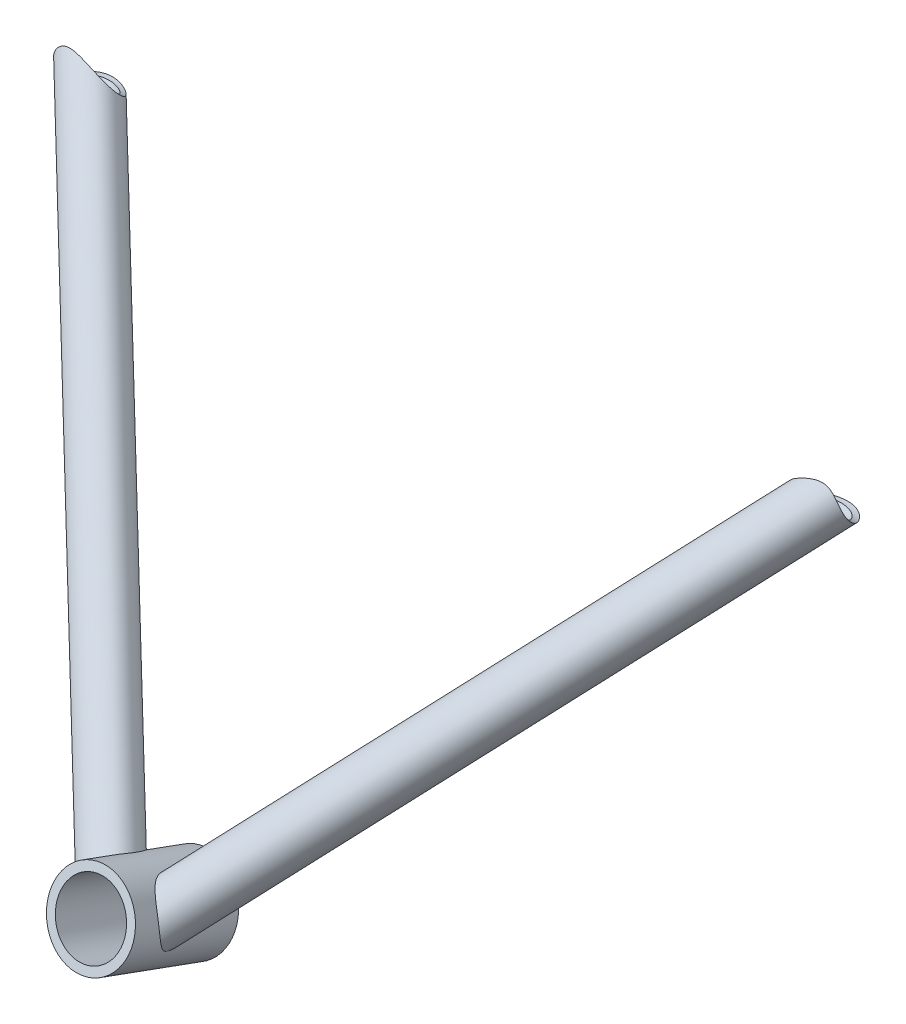
from build123d import *

# Parameters (mm, degrees)
SKETCH1_R               = 15.875
BOSS_EXTRUDE1_DEPTH     = 20.701
SWEEP1_PROFILE_R        = 9.525
SWEEP2_PROFILE_R        = 9.525
CUT_EXTRUDE2_REACH      = 371.805
SKETCH36_R              = 7.9375
CUT_EXTRUDE3_REACH      = 371.805
CUT_EXTRUDE3_END_RADIUS = 15.875
SKETCH37_R              = 7.9375
SKETCH77_R              = 15.875
BOSS_EXTRUDE2_DEPTH     = 41.402
CUT_EXTRUDE1_REACH      = 251.445
SKETCH2_R               = 12.7
SKETCH83_R              = 12.7


with BuildPart() as part:
    # Sketch1 → Boss-Extrude1 (new, symmetric)
    with BuildSketch(Plane(origin=(0, 0, 0), x_dir=(1, 0, 0), z_dir=(0, 0.34202014332566943, 0.9396926207859081))):
        with Locations(Location((0, 0, 0), (0, 0, 270))):
            Circle(SKETCH1_R)
    extrude(amount=BOSS_EXTRUDE1_DEPTH, both=True)

    # Sweep1: sweep along a path in Sketch4
    with BuildLine(Plane(origin=(0, 3.144101118, 3.616874596), x_dir=(1, 0, 0), z_dir=(0, 0.6560590289905084, 0.754709580222771))) as sweep1_path:
        Line((-5.08, -4.165974834), (-143.483994092, 193.495413453))
    # Sweep1 profile (on start of the path) → Sweep1 (sweep)
    with BuildSketch(Plane(origin=(-5.08, 0, 6.35), x_dir=(0.7330812283825076, 0.6801410975622587, 0), z_dir=(-0.5735764363510472, 0.6182218954839692, -0.5374120947718255))):
        Circle(SWEEP1_PROFILE_R)
    sweep(path=sweep1_path.line)

    # Sweep2: sweep along a path in Sketch15
    with BuildLine(Plane(origin=(0, 3.144101118, 3.616874596), x_dir=(1, 0, 0), z_dir=(0, 0.6560590289905084, 0.754709580222771))) as sweep2_path:
        Line((5.08, -4.165974834), (143.483994092, 193.495413453))
    # Sweep2 profile (on start of the path) → Sweep2 (sweep)
    with BuildSketch(Plane(origin=(5.08, 0, 6.35), x_dir=(0.7330812283825074, -0.6801410975622589, 0), z_dir=(0.5735764363510474, 0.6182218954839692, -0.5374120947718254))):
        Circle(SWEEP2_PROFILE_R)
    sweep(path=sweep2_path.line)

    # Sketch36 → Cut-Extrude2 (cut, up to next)
    with BuildSketch(Plane(origin=(-138.117895022, 148.868575223, -129.409478119), x_dir=(0.8191108775847741, 0.4394391101382058, -0.36871484741361205), z_dir=(-0.5735764363510472, 0.6182218954839691, -0.5374120947718255)), mode=Mode.PRIVATE) as cut_extrude2_sk1:
        with Locations(Location((-6.502422539, -4.857839146, 0), (0, 0, 154.073467295))):
            Circle(SKETCH36_R)
    cut_extrude2_tool1 = extrude(cut_extrude2_sk1.sketch, amount=-CUT_EXTRUDE2_REACH, mode=Mode.PRIVATE) & part.part
    add(cut_extrude2_tool1.solids().sort_by_distance((-143.483994, 149.176943, -123.327538))[0], mode=Mode.SUBTRACT)

    # Cut-Extrude3: up to this cylinder (the profile starts outside it)
    cut_extrude3_end = Plane(origin=(0, -22.186319293, -60.956411279), z_dir=(0, -0.34202014332566943, -0.9396926207859081)) * Cylinder(CUT_EXTRUDE3_END_RADIUS, 776.36, mode=Mode.PRIVATE)
    # Sketch37 → Cut-Extrude3 (cut, up to the surface)
    with BuildSketch(Plane(origin=(138.117895022, 148.868575223, -129.409478119), x_dir=(0.8191108775847737, -0.4394391101382061, 0.36871484741361227), z_dir=(0.5735764363510476, 0.6182218954839689, -0.5374120947718255)), mode=Mode.PRIVATE) as cut_extrude3_sk1:
        with Locations(Location((6.502422539, -4.857839146, 0), (0, 0, 205.926532705))):
            Circle(SKETCH37_R)
    cut_extrude3_tool1 = extrude(cut_extrude3_sk1.sketch, amount=-CUT_EXTRUDE3_REACH, mode=Mode.PRIVATE) - cut_extrude3_end
    add(cut_extrude3_tool1.solids().sort_by_distance((143.483994, 149.176943, -123.327538))[0], mode=Mode.SUBTRACT)

    # Sketch77 → Boss-Extrude2 (add)
    with BuildSketch(Plane(origin=(0, 7.080158987, 19.452576943), x_dir=(1, 0, 0), z_dir=(0, 0.34202014332566943, 0.9396926207859082))):
        with Locations(Location((0, 0, 0), (0, 0, 270))):
            Circle(SKETCH77_R)
    extrude(amount=-BOSS_EXTRUDE2_DEPTH)

    # Sketch2 → Cut-Extrude1 (cut, up to next)
    with BuildSketch(Plane(origin=(0, -7.080158987, -19.452576943), x_dir=(-1, 0, 0), z_dir=(0, -0.34202014332566943, -0.9396926207859081)), mode=Mode.PRIVATE) as cut_extrude1_sk1:
        with Locations(Location((0, 0, 0), (0, 0, 90))):
            Circle(SKETCH2_R)
    cut_extrude1_tool1 = extrude(cut_extrude1_sk1.sketch, amount=-CUT_EXTRUDE1_REACH, mode=Mode.PRIVATE) & part.part
    add(cut_extrude1_tool1.solids().sort_by_distance((0, -7.080159, -19.452577))[0], mode=Mode.SUBTRACT)

    # Cut-Sweep1: sweep along a path in Sketch40
    with BuildLine(Plane(origin=(-106.934, 0, -127), x_dir=(1, 0, 0), z_dir=(0, 0, 1))) as cut_sweep1_path:
        Line((-63.663829669, 149.860844852), (100.20235662, 162.304768472))
        ThreePointArc((100.20235662, 162.304768472), (106.934, 162.56), (113.66564338, 162.304768472))
        Line((113.66564338, 162.304768472), (277.531829669, 149.860844852))
    # Sketch83 → Cut-Sweep1 (sweep, cut)
    with BuildSketch(Plane(origin=(170.597829669, 149.860844852, -127), x_dir=(0, 0, 1), z_dir=(-0.99712900418122, 0.07572152283577528, 0))):
        with Locations((0, -0.255231528)):
            Circle(SKETCH83_R)
    sweep(path=cut_sweep1_path.line, mode=Mode.SUBTRACT)


solid = part.part
